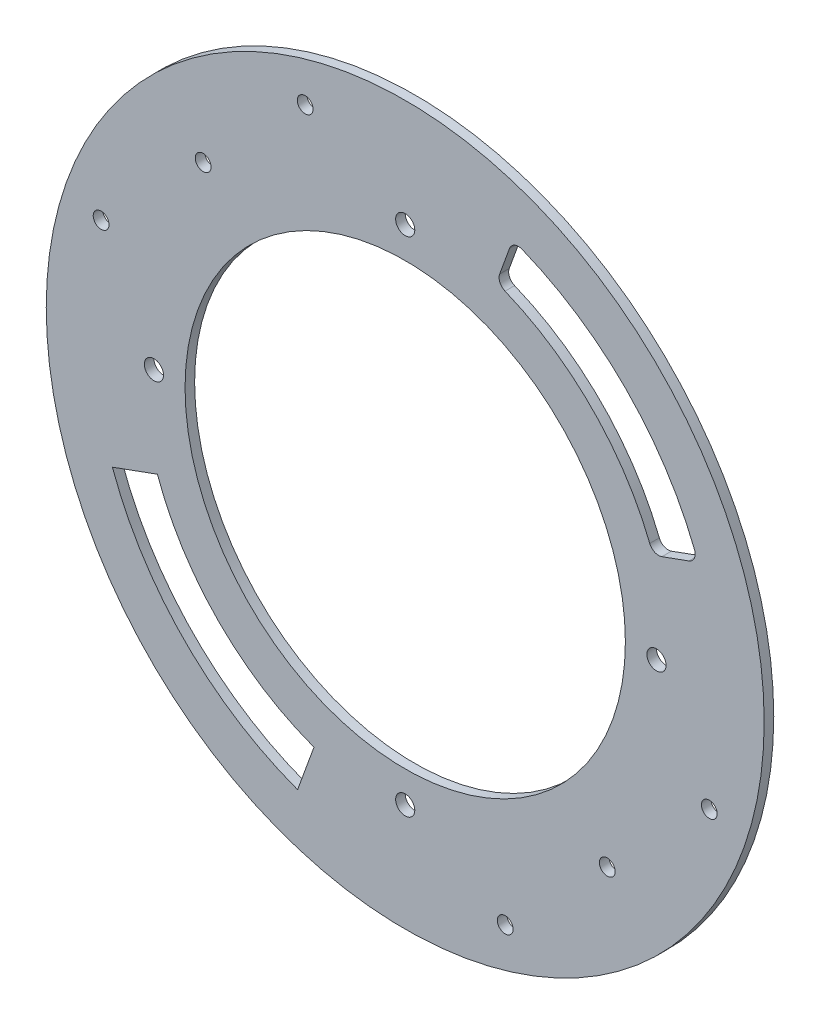
from build123d import *

# Parameters (mm, degrees)
SKETCH_1_R          = 75
SKETCH_1_R_2        = 2
SKETCH_1_R_3        = 46
EXTRUDE_1_DEPTH     = 2
CUT_EXTRUDE_2_DEPTH = 10
SKETCH_5_R          = 1.65
CUT_EXTRUDE_3_DEPTH = 10
FILLET_2_R          = 2


with BuildPart() as part:
    # 草图1 → 凸台-拉伸1 (new body)
    with BuildSketch(Plane.XY):
        Circle(SKETCH_1_R)
        with Locations((-52.5, 0)):
            Circle(SKETCH_1_R_2, mode=Mode.SUBTRACT)
        with Locations((0, 52.5)):
            Circle(SKETCH_1_R_2, mode=Mode.SUBTRACT)
        with Locations((52.5, 0)):
            Circle(SKETCH_1_R_2, mode=Mode.SUBTRACT)
        with Locations((0, -52.5)):
            Circle(SKETCH_1_R_2, mode=Mode.SUBTRACT)
        Circle(SKETCH_1_R_3, mode=Mode.SUBTRACT)
    extrude(amount=EXTRUDE_1_DEPTH)

    # 草图3 → 切除-拉伸2 (cut)
    with BuildSketch(Plane.XY.offset(2)):
        with BuildLine():
            Line((-51.775970298, -18.553945664), (-61.172994758, -21.974182859))
            ThreePointArc((-61.172994758, -21.974182859), (-46.153503513, -45.769576287), (-22.484399296, -60.98730842))
            Line((-22.484399296, -60.98730842), (-19.064163111, -51.59028673))
            ThreePointArc((-19.064163111, -51.59028673), (-39.082362813, -38.698435587), (-51.775970298, -18.553945664))
        make_face()
        with BuildLine():
            Line((51.775970298, 18.553945664), (61.172994758, 21.974182859))
            ThreePointArc((61.172994758, 21.974182859), (46.153503513, 45.769576287), (22.484399296, 60.98730842))
            Line((22.484399296, 60.98730842), (19.064163111, 51.59028673))
            ThreePointArc((19.064163111, 51.59028673), (39.082362813, 38.698435587), (51.775970298, 18.553945664))
        make_face()
    extrude(amount=-CUT_EXTRUDE_2_DEPTH, mode=Mode.SUBTRACT)

    # 草图5 → 切除-拉伸3 (cut)
    with BuildSketch(Plane.XY.offset(2)):
        with Locations((-63.53412763, 21.527067294)):
            Circle(SKETCH_5_R)
        with Locations((-42.216475186, 42.635304887)):
            Circle(SKETCH_5_R)
        with Locations((-20.898822743, 63.743542481)):
            Circle(SKETCH_5_R)
        with Locations((63.53412763, -21.527067294)):
            Circle(SKETCH_5_R)
        with Locations((42.216475186, -42.635304887)):
            Circle(SKETCH_5_R)
        with Locations((20.898822743, -63.743542481)):
            Circle(SKETCH_5_R)
    extrude(amount=-CUT_EXTRUDE_3_DEPTH, mode=Mode.SUBTRACT)

    # 圆角2
    fillet_2_edges = [part.edges().sort_by_distance(p)[0] for p in [
        (51.775970298, 18.553945664, 1),
        (19.064163111, 51.59028673, 1),
        (22.484399296, 60.98730842, 1),
        (61.172994758, 21.974182859, 1),
    ]]
    fillet(fillet_2_edges, radius=FILLET_2_R)


solid = part.part
